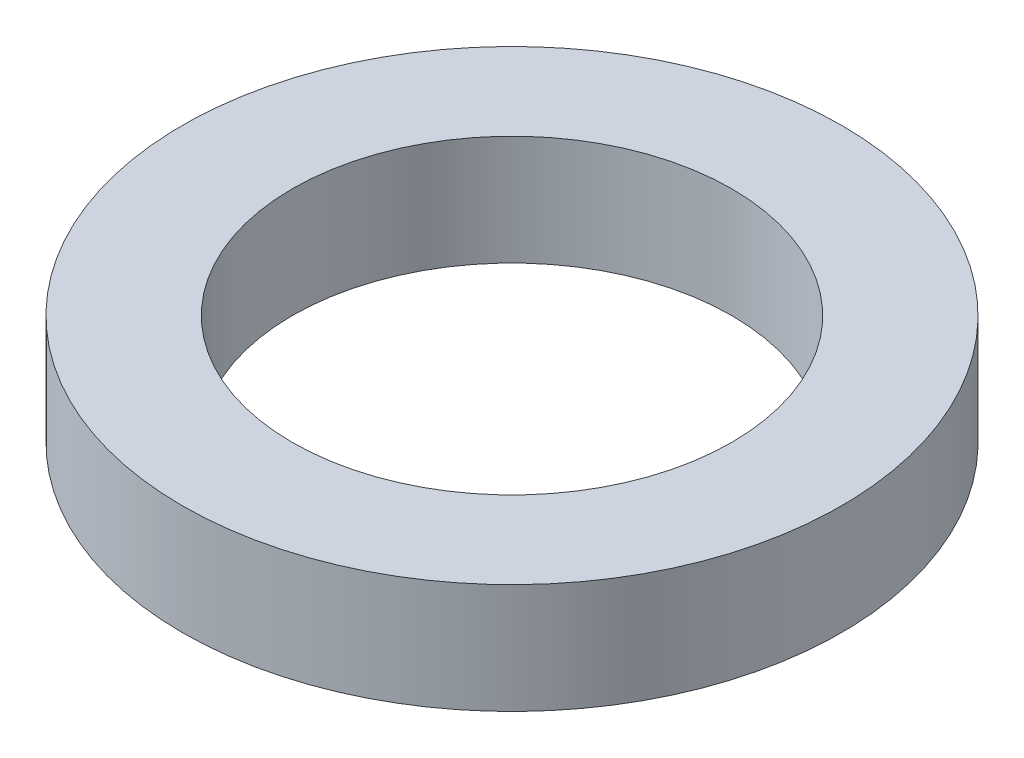
from build123d import *

# Parameters (mm, degrees)
SKETCH1_R           = 15
SKETCH1_R_2         = 10
BOSS_EXTRUDE1_DEPTH = 5


with BuildPart() as part:
    # Sketch1 → Boss-Extrude1 (new body)
    with BuildSketch(Plane(origin=(0, 0, 0), x_dir=(1, 0, 0), z_dir=(0, 1, 0))):
        with Locations(Location((0, 0, 0), (0, 0, 270))):
            Circle(SKETCH1_R)
        with Locations(Location((0, 0, 0), (0, 0, 270))):
            Circle(SKETCH1_R_2, mode=Mode.SUBTRACT)
    extrude(amount=BOSS_EXTRUDE1_DEPTH)


solid = part.part
